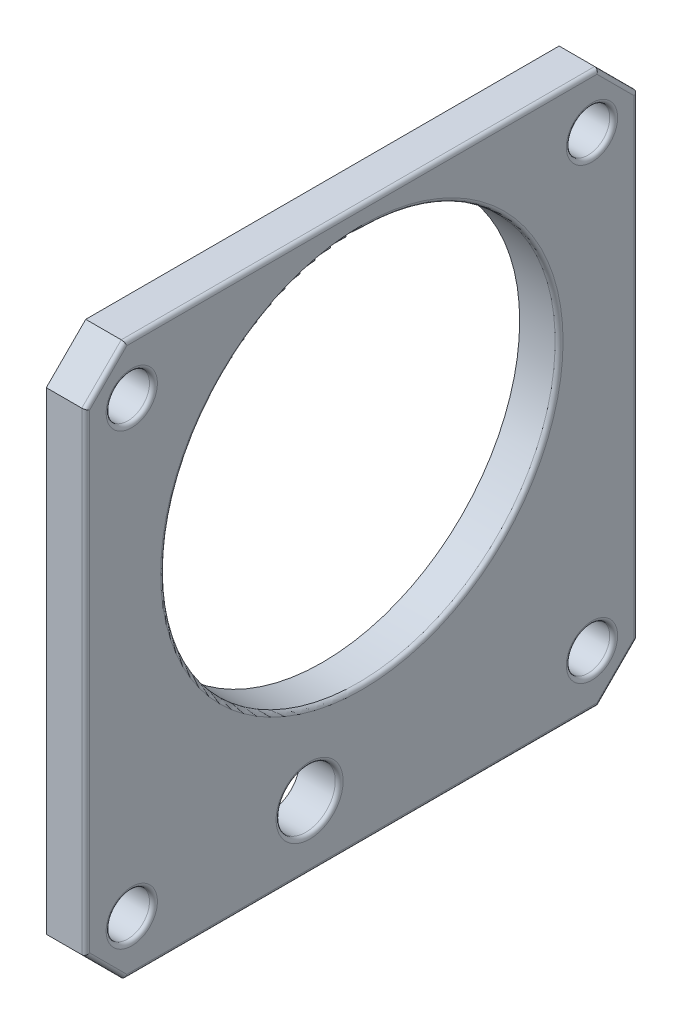
from build123d import *

# Parameters (mm, degrees)
SKETCH1_R               = 15
BOSS_EXTRUDE1_DEPTH     = 3
CUT_EXTRUDE1_DEPTH      = 30.849623113
CUT_EXTRUDE1_DEPTH_BACK = 30.849623113
SKETCH2_R               = 1.65
SKETCH4_R               = 2.25
CUT_EXTRUDE2_DEPTH      = 30.849623113
FILLET1_R               = 0.3


with BuildPart() as part:
    # Sketch1 → Boss-Extrude1 (new body)
    with BuildSketch(Plane(origin=(0, 0, 0), x_dir=(0, 0, -1), z_dir=(1, 0, 0))):
        Polygon((-21, 18), (-18, 21), (18, 21), (21, 18), (21, -18), (18, -21), (-18, -21), (-21, -18), align=None)
        with Locations((0, 4.4)):
            Circle(SKETCH1_R, mode=Mode.SUBTRACT)
    extrude(amount=BOSS_EXTRUDE1_DEPTH)

    # Sketch2 → Cut-Extrude1 (cut, two sides: drawn at the far end of the back side and taken through both)
    with BuildSketch(Plane.ZY.offset(-CUT_EXTRUDE1_DEPTH_BACK)):
        with Locations((-17.499503476, 17.062044783)):
            Circle(SKETCH2_R)
        with Locations((-17.499503476, -17.062044783)):
            Circle(SKETCH2_R)
        with Locations((17.499503476, -17.062044783)):
            Circle(SKETCH2_R)
        with Locations((17.499503476, 17.062044783)):
            Circle(SKETCH2_R)
    extrude(amount=CUT_EXTRUDE1_DEPTH + CUT_EXTRUDE1_DEPTH_BACK, mode=Mode.SUBTRACT)

    # Sketch4 → Cut-Extrude2 (cut, through all)
    with BuildSketch(Plane.ZY):
        with Locations((3.974971526, -16.2)):
            Circle(SKETCH4_R)
    extrude(amount=-CUT_EXTRUDE2_DEPTH, mode=Mode.SUBTRACT)

    # Fillet1
    fillet1_edges = [part.edges().sort_by_distance(p)[0] for p in [
        (3, 0, 21),
        (3, -19.5, 19.5),
        (3, -21, 0),
        (3, 4.4, 15),
        (3, -19.5, -19.5),
        (3, 0, -21),
        (3, 19.5, -19.5),
        (3, -17.062044783, 15.849503476),
        (3, 17.062044783, -19.149503476),
        (3, 17.062044783, 15.849503476),
        (3, -17.062044783, -19.149503476),
        (3, 21, 0),
        (3, -16.2, 1.724971526),
        (3, 19.5, 19.5),
    ]]
    fillet(fillet1_edges, radius=FILLET1_R)


solid = part.part
